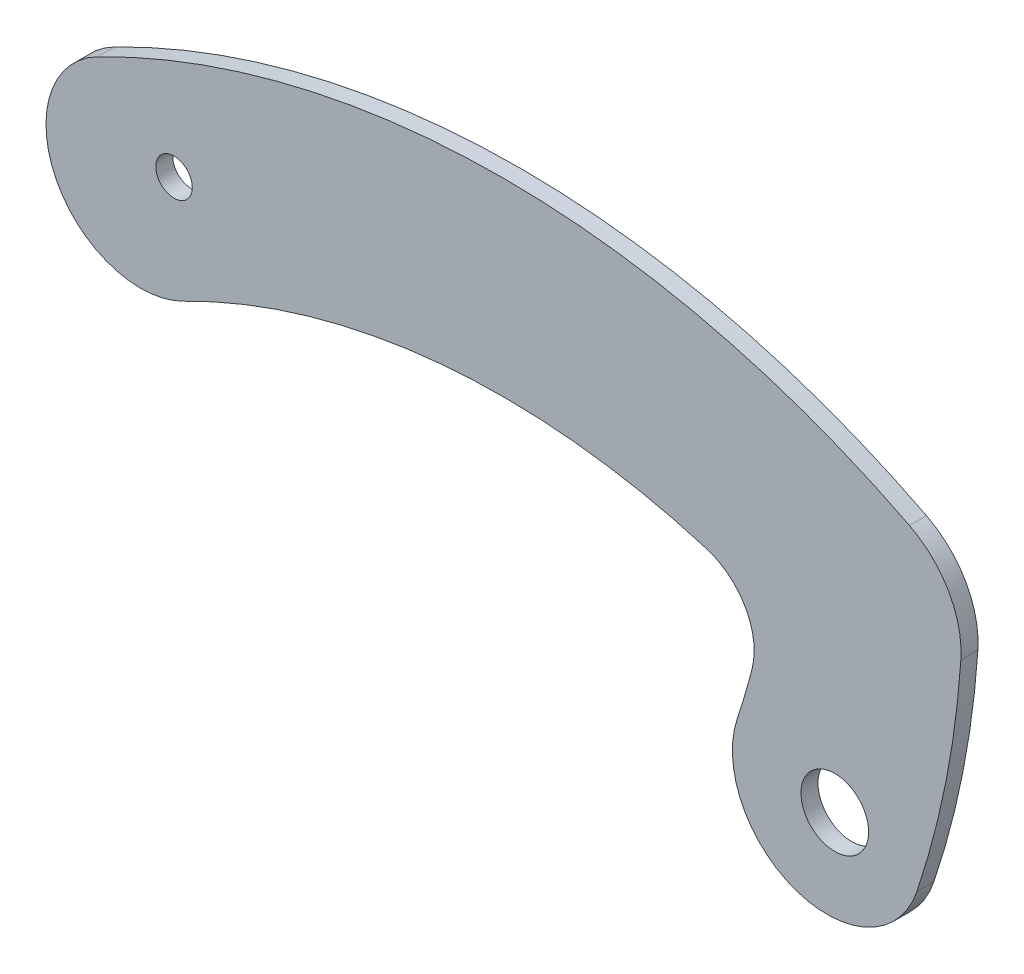
from build123d import *

# Parameters (mm, degrees)
BOSS_EXTRUDE1_DEPTH = 3.2004
SKETCH2_R           = 3.429
CUT_EXTRUDE1_DEPTH  = 3.2004
BOSS_EXTRUDE2_START = -3.2004
BOSS_EXTRUDE2_DEPTH = 3.2004
SKETCH4_R           = 6.35
CUT_EXTRUDE2_DEPTH  = 3.2004
FILLET1_R           = 12.7


with BuildPart() as part:
    # Sketch1 → Boss-Extrude1 (new body)
    with BuildSketch(Plane.XY):
        with BuildLine():
            ThreePointArc((-8.097097761, 15.832735205), (68.150612211, 34.198640293), (144.398322183, 15.832735205))
            ThreePointArc((144.398322183, 15.832735205), (152.133959628, -8.097097761), (128.204126662, -15.832735205))
            ThreePointArc((128.204126662, -15.832735205), (68.150612211, -1.367551307), (8.097097761, -15.832735205))
            ThreePointArc((8.097097761, -15.832735205), (-15.832735205, -8.097097761), (-8.097097761, 15.832735205))
        make_face()
    extrude(amount=BOSS_EXTRUDE1_DEPTH)

    # Sketch2 → Cut-Extrude1 (cut)
    with BuildSketch(Plane.XY.offset(3.2004)):
        with Locations((6.261836343, 3.437760818)):
            Circle(SKETCH2_R)
    extrude(amount=-CUT_EXTRUDE1_DEPTH, mode=Mode.SUBTRACT)

    # Sketch3 → Boss-Extrude2 (add)
    with BuildSketch(Plane.XY.offset(3.2004).offset(BOSS_EXTRUDE2_START)):
        with BuildLine():
            ThreePointArc((118.558560015, 1.198480685), (137.499705108, 17.742664408), (154.04388883, -1.198480685))
            ThreePointArc((154.04388883, -1.198480685), (151.248704167, -22.371604894), (145.781416871, -43.0167742))
            ThreePointArc((145.781416871, -43.0167742), (123.276823543, -54.242649292), (112.05094845, -31.738055964))
            ThreePointArc((112.05094845, -31.738055964), (116.357042584, -15.477699112), (118.558560015, 1.198480685))
        make_face()
    extrude(amount=BOSS_EXTRUDE2_DEPTH)

    # Sketch4 → Cut-Extrude2 (cut)
    with BuildSketch(Plane.XY.offset(3.2004)):
        with Locations((130.361522506, -37.860704571)):
            Circle(SKETCH4_R)
    extrude(amount=-CUT_EXTRUDE2_DEPTH, mode=Mode.SUBTRACT)

    # Fillet1
    fillet1_edges = [part.edges().sort_by_distance(p)[0] for p in [
        (117.190242121, -10.823434725, 1.6002),
    ]]
    fillet(fillet1_edges, radius=FILLET1_R)


solid = part.part
